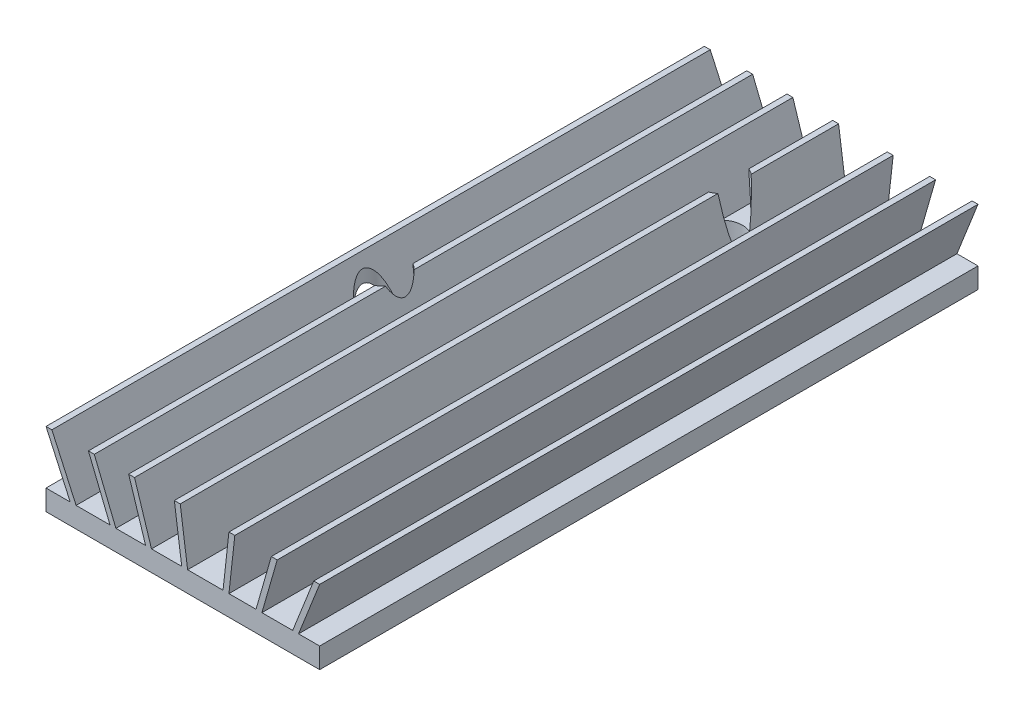
from build123d import *

# Parameters (mm, degrees)
SKETCH1_W               = 25.4
SKETCH1_H               = 1.905
BASE_DEPTH              = 61.1124
FINS_DEPTH              = 61.1124
CUT_EXTRUDE1_DEPTH      = 67.365786688
CUT_EXTRUDE1_DEPTH_BACK = 67.365786688
SKETCH3_R               = 1.9939


with BuildPart() as part:
    # Sketch1 → Base (new body)
    with BuildSketch(Plane.XY):
        with Locations((12.7, 0.9525)):
            Rectangle(SKETCH1_W, SKETCH1_H)
    extrude(amount=BASE_DEPTH)

    # Sketch2 → Fins (add)
    with BuildSketch(Plane(origin=(0, 0, 0), x_dir=(-1, 0, 0), z_dir=(0, 0, -1))):
        Polygon((-23.444268018, 1.905), (-25.4, 6.858), (-24.853831982, 6.858), (-22.8981, 1.905), align=None)
        Polygon((-20.040531982, 1.905), (-19.494363964, 1.905), (-20.916831982, 6.858), (-21.463, 6.858), align=None)
        Polygon((-16.979831982, 1.905), (-16.433663964, 1.905), (-16.979831982, 6.858), (-17.526, 6.858), align=None)
        Polygon((-2.794, 1.905), (-2.247831982, 1.905), (0, 6.858), (-0.546168018, 6.858), align=None)
        Polygon((-12.458768018, 6.858), (-11.9126, 6.858), (-12.598263964, 1.905), (-13.144431982, 1.905), align=None)
        Polygon((-8.216968018, 6.858), (-7.6708, 6.858), (-9.245463964, 1.905), (-9.791631982, 1.905), align=None)
        Polygon((-4.483168018, 6.858), (-3.937, 6.858), (-5.943463964, 1.905), (-6.489631982, 1.905), align=None)
    extrude(amount=-FINS_DEPTH)

    # Sketch3 → Cut-Extrude1 (cut, two sides: drawn at the far end of the back side and taken through both)
    with BuildSketch(Plane(origin=(0, 1.905, 0), x_dir=(1, 0, 0), z_dir=(0, 1, 0)).offset(-CUT_EXTRUDE1_DEPTH_BACK)):
        with Locations(Location((11.2, -9.655, 0), (0, 0, 180))):
            Circle(SKETCH3_R)
        with Locations(Location((3, -32.755, 0), (0, 0, 180))):
            Circle(SKETCH3_R)
    extrude(amount=CUT_EXTRUDE1_DEPTH + CUT_EXTRUDE1_DEPTH_BACK, mode=Mode.SUBTRACT)


solid = part.part
